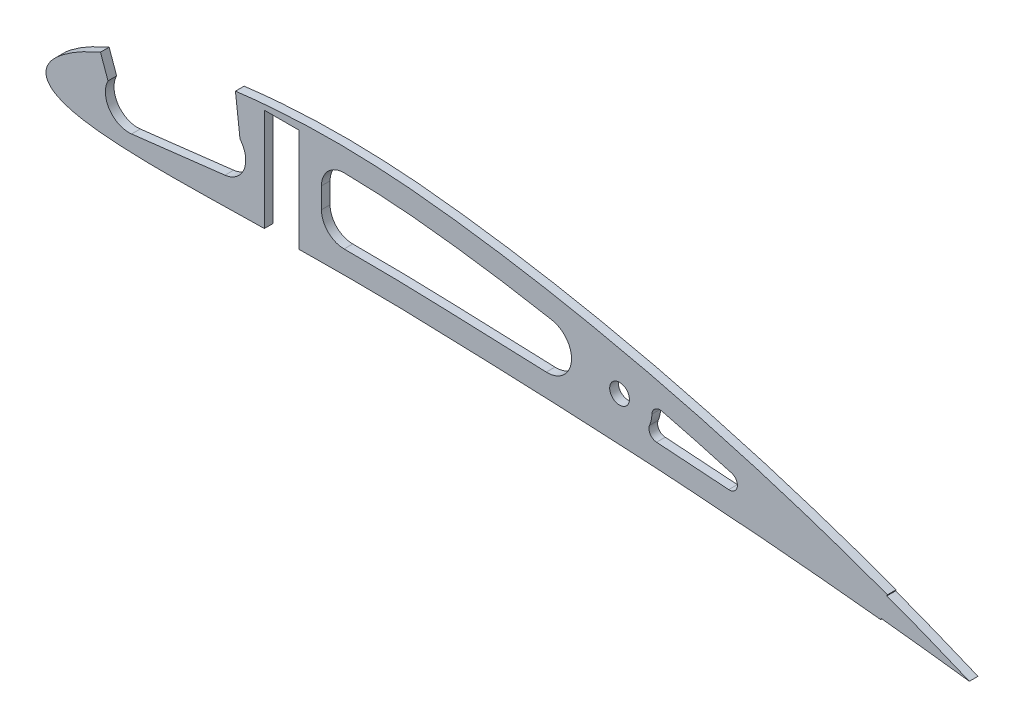
from build123d import *

# Parameters (mm, degrees)
SKETCH1_R           = 3.8862
BOSS_EXTRUDE1_DEPTH = 3.4036


with BuildPart() as part:
    # Sketch1 → Boss-Extrude1 (new body)
    with BuildSketch(Plane.XY):
        with BuildLine():
            Line((2483.023980975, 2830.955342148), (2519.777608908, 2835.285249151))
            ThreePointArc((2519.777608908, 2835.285249151), (2527.319863632, 2841.125136195), (2525.694170086, 2850.52444508))
            Line((2525.694170086, 2850.52444508), (2523.895941315, 2865.993429263))
            add(Edge.make_bspline(
                [(2780.542721306, 2822.605020678), (2778.253003884, 2823.458980516), (2775.973270324, 2824.328257932), (2770.710976164, 2826.211267821), (2767.725148574, 2827.263379627), (2758.748784649, 2830.452533672), (2752.683897054, 2832.439967039), (2740.538782354, 2836.35735663), (2734.455623744, 2838.278358675), (2722.213291432, 2841.879774299), (2716.066133268, 2843.597804263), (2703.759263564, 2846.995524774), (2697.56608772, 2848.535141926), (2685.197798544, 2851.656767301), (2678.980101095, 2853.040770642), (2659.245529669, 2857.380953253), (2645.743376553, 2859.954697057), (2623.385680041, 2863.50435515), (2614.720124938, 2864.728067498), (2599.841966526, 2866.43967058), (2593.711900835, 2867.105354026), (2581.391633876, 2867.958108609), (2575.218871474, 2868.251024198), (2562.883621226, 2868.506947472), (2556.711754315, 2868.442582898), (2544.37468429, 2867.937420798), (2538.213546048, 2867.537560449), (2529.344015147, 2866.656984731), (2526.617234193, 2866.346019973), (2523.895941315, 2865.993429263)],
                knots=[1.615895701, 1.615895701, 1.615895701, 1.615895701, 1.904435817, 1.904435817, 2.27721661, 2.27721661, 3.031526478, 3.031526478, 3.785836345, 3.785836345, 4.540146213, 4.540146213, 5.29445608, 5.29445608, 6.048765948, 6.048765948, 7.680004167, 7.680004167, 8.718618599, 8.718618599, 9.449269402, 9.449269402, 10.179920204, 10.179920204, 10.910571006, 10.910571006, 11.641221808, 11.641221808, 11.966162559, 11.966162559, 11.966162559, 11.966162559], degree=3))
            Line((2780.542721306, 2822.605020678), (2780.366179259, 2822.131615694))
            add(Edge.make_bspline(
                [(2812.811153408, 2809.248633243), (2811.742721472, 2809.69557433), (2810.661000778, 2810.141061351), (2805.162016263, 2812.421901494), (2800.746808293, 2814.209651042), (2791.811027497, 2817.8308926), (2787.390855916, 2819.526437421), (2782.055306735, 2821.504895189), (2781.210779035, 2821.818389545), (2780.366179259, 2822.131615694)],
                knots=[0.240373092, 0.240373092, 0.240373092, 0.240373092, 0.376824745, 0.376824745, 0.94322841, 0.94322841, 1.509632074, 1.509632074, 1.616176715, 1.616176715, 1.616176715, 1.616176715], degree=3))
            add(Edge.make_bspline(
                [(2778.019298543, 2813.343972358), (2779.174843082, 2813.216959045), (2780.33031454, 2813.087473515), (2787.996855373, 2812.209848611), (2794.540348084, 2811.500898092), (2804.935623835, 2810.221587249), (2808.829276968, 2809.701678096), (2812.811153408, 2809.248633243)],
                knots=[28.432746502, 28.432746502, 28.432746502, 28.432746502, 28.569989508, 28.569989508, 29.343340852, 29.343340852, 29.81381441, 29.81381441, 29.81381441, 29.81381441], degree=3))
            Line((2778.019298543, 2813.343972358), (2777.967751396, 2812.820060367))
            add(Edge.make_bspline(
                [(2548.870346536, 2824.567775924), (2549.880763048, 2824.580477774), (2552.565327641, 2824.615707873), (2556.947797606, 2824.676583949), (2562.030529235, 2824.678334647), (2567.173828356, 2824.693500153), (2572.377983544, 2824.709196535), (2577.654631688, 2824.67696147), (2582.978163683, 2824.582046793), (2588.350084988, 2824.536119888), (2593.779620592, 2824.351271255), (2599.307416132, 2824.197179686), (2604.908682597, 2824.018609119), (2610.572157053, 2823.866492961), (2616.257225785, 2823.621981602), (2621.969941233, 2823.476511904), (2627.679751972, 2823.245652948), (2633.40209681, 2823.033589705), (2639.136822152, 2822.829576657), (2644.868715349, 2822.565091369), (2650.588345306, 2822.312806877), (2656.296308508, 2822.080669661), (2661.987661359, 2821.759322661), (2667.671808974, 2821.555637659), (2673.311212153, 2821.203058391), (2678.915236244, 2820.89497077), (2684.481545426, 2820.575494462), (2690.011544993, 2820.273101276), (2695.489391996, 2819.927627801), (2700.902150582, 2819.53908503), (2706.254125464, 2819.168109124), (2711.544005033, 2818.795089042), (2716.748448208, 2818.440196261), (2721.876237554, 2818.04936914), (2726.912041029, 2817.595657199), (2731.881695192, 2817.241551537), (2736.757779223, 2816.804763884), (2741.539063821, 2816.415585152), (2746.215557291, 2815.961521287), (2750.770763986, 2815.536143199), (2755.214578157, 2815.113731136), (2759.534567055, 2814.695121871), (2763.74642736, 2814.308374678), (2767.826055945, 2813.842732195), (2771.793322217, 2813.488663634), (2775.151456937, 2813.092516309), (2777.200029602, 2812.895595703), (2777.967751396, 2812.820060367)],
                knots=[19.396955855, 19.396955855, 19.396955855, 19.396955855, 19.516306022, 19.714059236, 19.914611374, 20.116619667, 20.321540433, 20.529276424, 20.739840618, 20.950404813, 21.163744737, 21.381461041, 21.603553869, 21.825646696, 22.050605171, 22.275615756, 22.500574231, 22.725532706, 22.951950418, 23.17832576, 23.403241591, 23.628157423, 23.853040081, 24.076496408, 24.299895492, 24.520374829, 24.739394295, 24.958413761, 25.174498693, 25.387658693, 25.599358693, 25.808138693, 26.013998693, 26.215483983, 26.415525295, 26.611170743, 26.803912863, 26.993735323, 27.177747459, 27.358840435, 27.534095176, 27.704971321, 27.871468943, 28.033634134, 28.189915523, 28.34186779, 28.432980691, 28.432980691, 28.432980691, 28.432980691], degree=3))
            Line((2548.870346536, 2824.567775924), (2548.863805049, 2825.088143073))
            Line((2548.863805049, 2825.088143073), (2548.863805049, 2865.192910216))
            Line((2548.863805049, 2865.192910216), (2535.274805049, 2865.192910216))
            Line((2535.274805049, 2865.192910216), (2535.274805049, 2824.843047695))
            add(Edge.make_bspline(
                [(2470.766103702, 2852.710144431), (2470.646363815, 2852.658056759), (2470.526712246, 2852.605770249), (2466.913650609, 2851.01966366), (2463.464058775, 2849.344254159), (2457.884399007, 2845.915542636), (2455.608911301, 2844.322120429), (2451.964070041, 2840.97525186), (2450.465728267, 2839.247391174), (2449.289153427, 2836.040655092), (2449.156845546, 2834.739769527), (2449.952027869, 2832.364010811), (2450.809883366, 2831.314787526), (2452.679965619, 2829.832414271), (2453.700996299, 2829.274855137), (2455.737837909, 2828.335754604), (2456.824400221, 2827.965046681), (2460.204069688, 2826.907372605), (2462.568258916, 2826.447378923), (2467.320698583, 2825.671812343), (2469.719825171, 2825.406035518), (2476.948343474, 2824.764545606), (2481.784959026, 2824.511198373), (2491.469537197, 2824.281172127), (2496.312043463, 2824.269915507), (2511.07935418, 2824.353879033), (2520.979134882, 2824.58426729), (2532.350045622, 2824.787023806), (2533.812383917, 2824.814763735), (2535.274805049, 2824.843047695)],
                knots=[14.135708649, 14.135708649, 14.135708649, 14.135708649, 14.151211266, 14.151211266, 14.60418364, 14.60418364, 14.932415743, 14.932415743, 15.199764537, 15.199764537, 15.36293217, 15.36293217, 15.526099802, 15.526099802, 15.662859963, 15.662859963, 15.799620124, 15.799620124, 16.08612483, 16.08612483, 16.372629537, 16.372629537, 16.94563895, 16.94563895, 17.518648363, 17.518648363, 18.689255122, 18.689255122, 18.862005391, 18.862005391, 18.862005391, 18.862005391], degree=3))
            Line((2470.766103702, 2852.710144431), (2473.727927056, 2844.402355581))
            ThreePointArc((2473.727927056, 2844.402355581), (2474.331071197, 2834.882581205), (2483.023980975, 2830.955342148))
        make_face()
        with Locations((2675.105839614, 2838.441821398)):
            Circle(SKETCH1_R, mode=Mode.SUBTRACT)
        with BuildLine():
            Line((2557.75380505, 2850.637738035), (2557.753805049, 2842.473355086))
            ThreePointArc((2557.753805049, 2842.473355086), (2560.364468394, 2836.180340612), (2566.663148395, 2833.58337613))
            add(Edge.make_bspline(
                [(2566.663148395, 2833.58337613), (2567.439822141, 2833.585066063), (2568.21832178, 2833.586808462), (2573.587092614, 2833.59977597), (2578.32788588, 2833.544491876), (2585.825022944, 2833.442267746), (2589.036358319, 2833.399484073), (2595.165089719, 2833.20850923), (2598.167336091, 2833.123111358), (2604.257712531, 2832.936390993), (2607.248172017, 2832.858137525), (2612.867384093, 2832.669542271), (2615.291016485, 2832.561728236), (2620.124092488, 2832.410356947), (2622.661869101, 2832.338603107), (2627.621694753, 2832.149552246), (2630.051078266, 2832.05365757), (2637.052732353, 2831.79686091), (2641.706061455, 2831.604052118), (2646.263618968, 2831.403053725)],
                knots=[20.098452244, 20.098452244, 20.098452244, 20.098452244, 20.190362895, 20.190362895, 20.729094517, 20.729094517, 21.088163559, 21.088163559, 21.4472326, 21.4472326, 21.806301641, 21.806301641, 22.096767949, 22.096767949, 22.387234257, 22.387234257, 22.677700566, 22.677700566, 23.217183906, 23.217183906, 23.217183906, 23.217183906], degree=3))
            ThreePointArc((2646.263618968, 2831.403053725), (2656.146412526, 2839.834905592), (2648.426111877, 2850.283000744))
            add(Edge.make_bspline(
                [(2648.426111877, 2850.283000744), (2641.59243129, 2851.55485833), (2634.73375431, 2852.723047867), (2619.325224165, 2855.108280696), (2610.871110121, 2856.241283208), (2595.715687801, 2857.94554503), (2589.314555675, 2858.544394121), (2577.427735136, 2859.245035452), (2572.084779046, 2859.456342149), (2566.761726328, 2859.526955918)],
                knots=[6.961493486, 6.961493486, 6.961493486, 6.961493486, 7.79451578, 7.79451578, 8.825426338, 8.825426338, 9.617156173, 9.617156173, 10.265753337, 10.265753337, 10.265753337, 10.265753337], degree=3))
            ThreePointArc((2566.761726328, 2859.526955918), (2560.399456411, 2856.965471443), (2557.75380505, 2850.637738035))
        make_face(mode=Mode.SUBTRACT)
        with BuildLine():
            ThreePointArc((2686.916771023, 2833.570149642), (2687.580669946, 2835.683217653), (2687.869645343, 2837.879193841))
            ThreePointArc((2687.869645343, 2837.879193841), (2689.145550797, 2840.286090247), (2691.817251109, 2840.818164007))
            add(Edge.make_bspline(
                [(2719.203869949, 2833.467480752), (2714.238092072, 2834.888047691), (2709.231509514, 2836.291040915), (2700.184998092, 2838.708065706), (2696.020099344, 2839.759276625), (2691.817251109, 2840.818164007)],
                knots=[4.060379897, 4.060379897, 4.060379897, 4.060379897, 4.675695902, 4.675695902, 5.188469227, 5.188469227, 5.188469227, 5.188469227], degree=3))
            ThreePointArc((2719.203869949, 2833.467480752), (2721.456611216, 2829.859214248), (2718.098293363, 2827.24844203))
            add(Edge.make_bspline(
                [(2689.668722188, 2829.189783747), (2690.923606701, 2829.117266622), (2692.18303199, 2829.042123136), (2699.065872366, 2828.606532746), (2704.600706314, 2828.194262638), (2712.774522449, 2827.622197512), (2715.42427843, 2827.444637901), (2718.098293363, 2827.24844203)],
                knots=[24.923660459, 24.923660459, 24.923660459, 24.923660459, 25.070608892, 25.070608892, 25.727122197, 25.727122197, 26.039951507, 26.039951507, 26.039951507, 26.039951507], degree=3))
            ThreePointArc((2689.668722188, 2829.189783747), (2687.163429033, 2830.670476464), (2686.916771023, 2833.570149642))
        make_face(mode=Mode.SUBTRACT)
    extrude(amount=BOSS_EXTRUDE1_DEPTH)


solid = part.part
